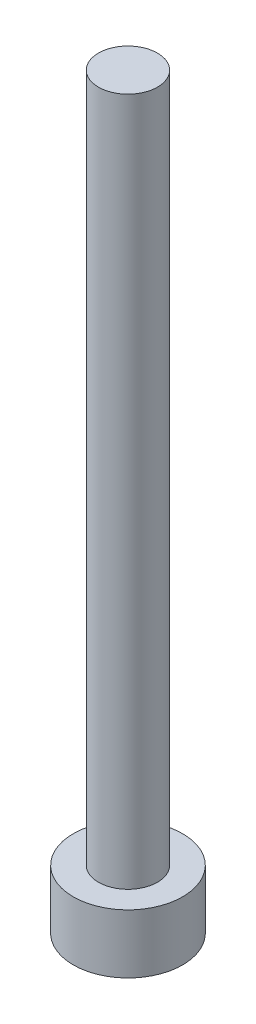
from build123d import *

# Parameters (mm, degrees)
SKETCH1_R           = 2.78
BOSS_EXTRUDE1_DEPTH = 3
SKETCH2_R           = 1.5
BOSS_EXTRUDE2_DEPTH = 35


with BuildPart() as part:
    # Sketch1 → Boss-Extrude1 (new body)
    with BuildSketch(Plane(origin=(0, 0, 0), x_dir=(1, 0, 0), z_dir=(0, 1, 0))):
        with Locations(Location((0, 0, 0), (0, 0, 270))):
            Circle(SKETCH1_R)
    extrude(amount=BOSS_EXTRUDE1_DEPTH)

    # Sketch2 → Boss-Extrude2 (add)
    with BuildSketch(Plane(origin=(0, 3, 0), x_dir=(1, 0, 0), z_dir=(0, 1, 0))):
        with Locations(Location((0, 0, 0), (0, 0, 270))):
            Circle(SKETCH2_R)
    extrude(amount=BOSS_EXTRUDE2_DEPTH)


solid = part.part
